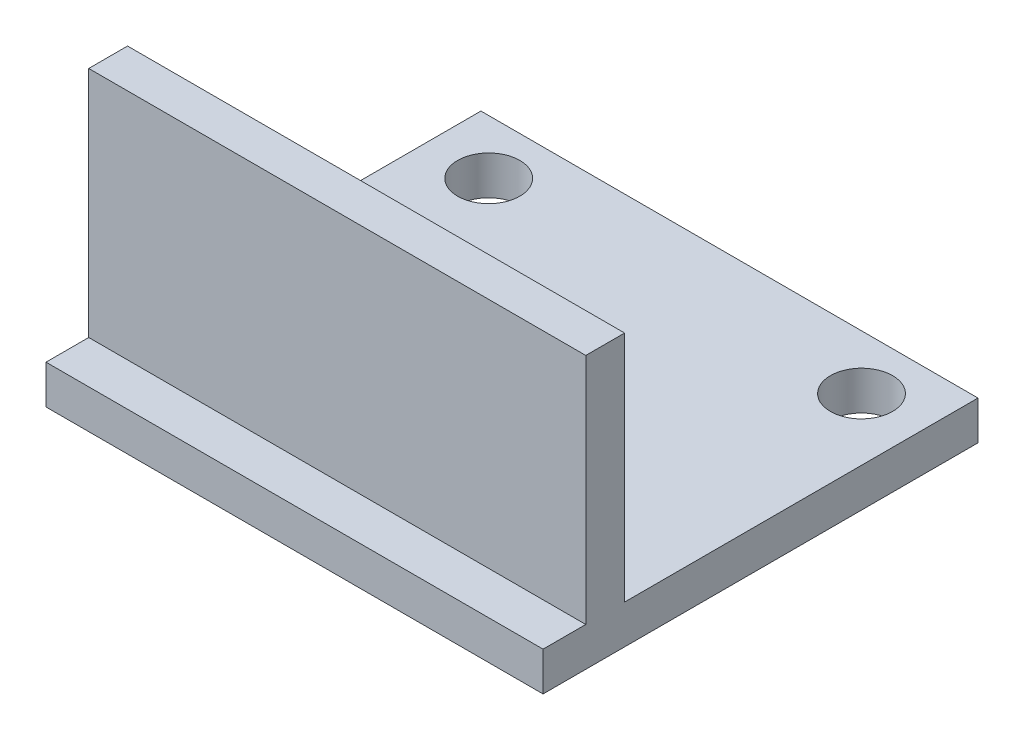
from build123d import *

# Parameters (mm, degrees)
SKETCH2_W           = 20.32
SKETCH2_H           = 17.78
SKETCH2_R           = 1.27
BOSS_EXTRUDE1_DEPTH = 1.5875
SKETCH3_W           = 20.32
SKETCH3_H           = 1.5875
BOSS_EXTRUDE2_DEPTH = 9.525


with BuildPart() as part:
    # Sketch2 → Boss-Extrude1 (new body)
    with BuildSketch(Plane(origin=(0, 0, 0), x_dir=(1, 0, 0), z_dir=(0, 1, 0))):
        Rectangle(SKETCH2_W, SKETCH2_H)
        with Locations(Location((-7.62, 6.6675, 0), (0, 0, 270))):
            Circle(SKETCH2_R, mode=Mode.SUBTRACT)
        with Locations(Location((7.62, 6.6675, 0), (0, 0, 90))):
            Circle(SKETCH2_R, mode=Mode.SUBTRACT)
    extrude(amount=BOSS_EXTRUDE1_DEPTH)

    # Sketch3 → Boss-Extrude2 (add)
    with BuildSketch(Plane(origin=(0, 1.5875, 0), x_dir=(1, 0, 0), z_dir=(0, 1, 0))):
        with Locations((0, -6.35)):
            Rectangle(SKETCH3_W, SKETCH3_H)
    extrude(amount=BOSS_EXTRUDE2_DEPTH)


solid = part.part
